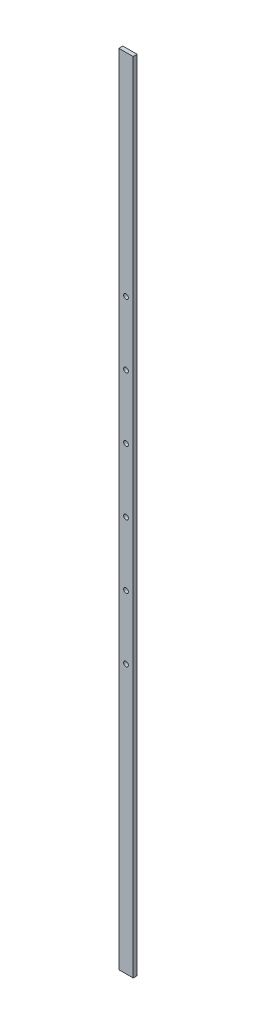
from build123d import *

# Parameters (mm, degrees)
SKETCH1_W           = 18
SKETCH1_H           = 1003
BOSS_EXTRUDE1_DEPTH = 5
SKETCH2_R           = 3
CUT_EXTRUDE1_DEPTH  = 5
LPATTERN1_COUNT     = 6
LPATTERN1_PITCH     = 80


with BuildPart() as part:
    # Sketch1 → Boss-Extrude1 (new body)
    with BuildSketch(Plane.XY):
        Rectangle(SKETCH1_W, SKETCH1_H)
    extrude(amount=BOSS_EXTRUDE1_DEPTH)

    # Sketch2 → Cut-Extrude1 (cut)
    with BuildSketch(Plane.XY.offset(5)):
        with Locations((0, 235.85)):
            Circle(SKETCH2_R)
    cut_extrude1 = extrude(amount=-CUT_EXTRUDE1_DEPTH, mode=Mode.SUBTRACT)

    # LPattern1: Cut-Extrude1 ×6
    with Locations(*[(0, -i * LPATTERN1_PITCH, 0) for i in range(1, LPATTERN1_COUNT)]):
        add(cut_extrude1, mode=Mode.SUBTRACT)


solid = part.part
